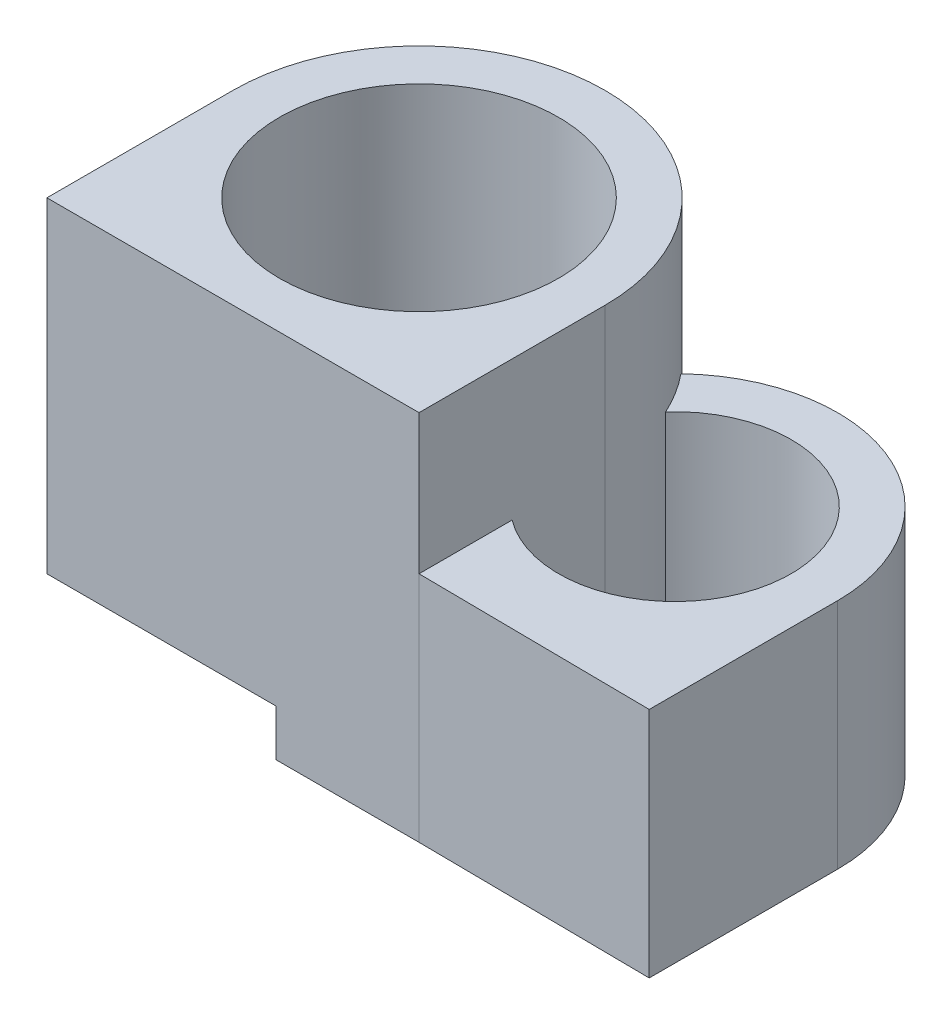
from build123d import *

# Parameters (mm, degrees)
SKETCH1_R           = 3
BOSS_EXTRUDE1_DEPTH = 7
BOSS_EXTRUDE2_START = 1
BOSS_EXTRUDE2_DEPTH = 1
BOSS_EXTRUDE6_DEPTH = 5


with BuildPart() as part:
    # Sketch1 → Boss-Extrude1 (new body)
    with BuildSketch(Plane(origin=(0, 0, 0), x_dir=(1, 0, 0), z_dir=(0, 1, 0))):
        with BuildLine():
            Line((4, 0), (4, -4))
            Line((4, -4), (-4, -4))
            Line((-4, -4), (-4, 0))
            ThreePointArc((-4, 0), (0, 4), (4, 0))
        make_face()
        with Locations(Location((0, 0, 0), (0, 0, 90))):
            Circle(SKETCH1_R, mode=Mode.SUBTRACT)
    extrude(amount=BOSS_EXTRUDE1_DEPTH)

    # Sketch4 → Boss-Extrude2 (add)
    with BuildSketch(Plane.XZ.offset(BOSS_EXTRUDE2_START)):
        with BuildLine():
            Line((4, 0), (4, 4))
            Line((4, 4), (0.924622027, 4))
            Line((0.924622027, 4), (0.924622027, 2.853957622))
            ThreePointArc((0.924622027, 2.853957622), (2.426300278, 1.764388551), (3, 0))
            ThreePointArc((3, 0), (2.426300278, -1.764388551), (0.924622027, -2.853957622))
            Line((0.924622027, -2.853957622), (0.924622027, -3.891667266))
            Line((0.924622027, -3.891667266), (4, 0))
        make_face()
    extrude(amount=-BOSS_EXTRUDE2_DEPTH)

    # Sketch6 → Boss-Extrude6 (add)
    with BuildSketch(Plane.XZ.offset(1)):
        with BuildLine():
            Line((3.209082629, -1.000848439), (2.532928766, -1.856472001))
            ThreePointArc((2.532928766, -1.856472001), (6.465725292, -3.364130595), (9, 0))
            Line((9, 0), (9, 4.051493621))
            Line((9, 4.051493621), (4, 4))
            Line((4, 4), (4, 2))
            ThreePointArc((4, 2), (6.618033989, 2.236067977), (8, 0))
            ThreePointArc((8, 0), (6.011227235, -2.447171166), (3.209082629, -1.000848439))
        make_face()
    extrude(amount=-BOSS_EXTRUDE6_DEPTH)


solid = part.part
